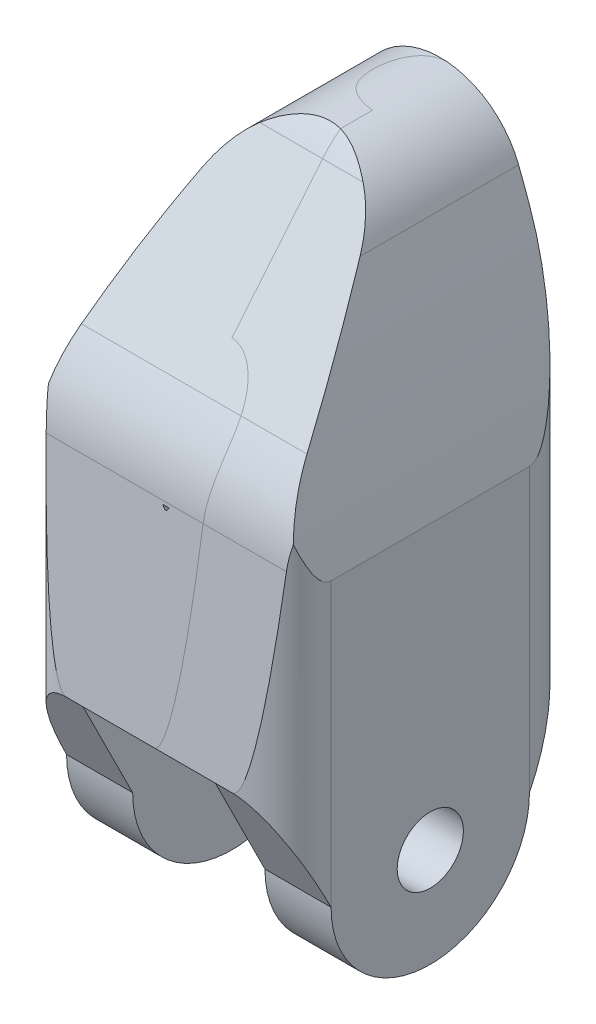
from build123d import *

# Parameters (mm, degrees)
BOSS_EXTRUDE1_DEPTH = 50.8
CUT_EXTRUDE2_START  = -20.32
SKETCH3_R           = 1.27
CUT_EXTRUDE2_DEPTH  = 50.8
CUT_EXTRUDE1_DEPTH  = 50.8
SKETCH4_W           = 10.16
SKETCH4_H           = 15.24
CUT_EXTRUDE3_DEPTH  = 50.8
SKETCH5_R           = 2.54
CUT_EXTRUDE5_DEPTH  = 50.8
CUT_EXTRUDE6_DEPTH  = 32.512
CUT_EXTRUDE7_DEPTH  = 32.512


with BuildPart() as part:
    # Sketch1 → Boss-Extrude1 (new body)
    with BuildSketch(Plane(origin=(0, 0, 0), x_dir=(1, 0, 0), z_dir=(0, 1, 0))):
        with BuildLine():
            Line((-20.32, 27.095319289), (-20.32, 11.855319289))
            ThreePointArc((-20.32, 11.855319289), (-19.204076836, 9.161242453), (-16.51, 8.045319289))
            Line((-16.51, 8.045319289), (-3.81, 8.045319289))
            ThreePointArc((-3.81, 8.045319289), (-1.115923164, 9.161242453), (0, 11.855319289))
            Line((0, 11.855319289), (0, 27.095319289))
            ThreePointArc((0, 27.095319289), (-1.115923164, 29.789396126), (-3.81, 30.905319289))
            Line((-3.81, 30.905319289), (-16.51, 30.905319289))
            ThreePointArc((-16.51, 30.905319289), (-19.204076836, 29.789396126), (-20.32, 27.095319289))
        make_face()
    extrude(amount=BOSS_EXTRUDE1_DEPTH)

    # Sketch3 → Cut-Extrude2 (cut)
    with BuildSketch(Plane(origin=(0, 50.8, 0), x_dir=(1, 0, 0), z_dir=(0, 1, 0)).offset(CUT_EXTRUDE2_START)):
        with Locations(Location((-10.16, 10.585319289, 0), (0, 0, 270))):
            Circle(SKETCH3_R)
        with Locations(Location((-10.16, 28.365319289, 0), (0, 0, 270))):
            Circle(SKETCH3_R)
    extrude(amount=-CUT_EXTRUDE2_DEPTH, mode=Mode.SUBTRACT)

    # Sketch2 → Cut-Extrude1 (cut)
    with BuildSketch(Plane.ZY.offset(20.32)):
        with BuildLine():
            Line((-27.095319289, 7.62), (-30.905319289, 15.24))
            Line((-30.905319289, 15.24), (-30.905319289, -5.08))
            Line((-30.905319289, -5.08), (-8.045319289, -5.08))
            Line((-8.045319289, -5.08), (-8.045319289, 15.24))
            Line((-8.045319289, 15.24), (-11.855319289, 7.62))
            ThreePointArc((-11.855319289, 7.62), (-19.475319289, 0), (-27.095319289, 7.62))
        make_face()
    extrude(amount=-CUT_EXTRUDE1_DEPTH, mode=Mode.SUBTRACT)

    # Sketch4 → Cut-Extrude3 (cut)
    with BuildSketch(Plane.XY.offset(-8.045319289)):
        with Locations((-10.16, 7.62)):
            Rectangle(SKETCH4_W, SKETCH4_H)
    extrude(amount=-CUT_EXTRUDE3_DEPTH, mode=Mode.SUBTRACT)

    # Sketch5 → Cut-Extrude5 (cut)
    with BuildSketch(Plane.ZY.offset(20.32)):
        with Locations((-19.475319289, 7.62)):
            Circle(SKETCH5_R)
    extrude(amount=-CUT_EXTRUDE5_DEPTH, mode=Mode.SUBTRACT)

    # Sketch6 → Cut-Extrude6 (cut)
    with BuildSketch(Plane.ZY.offset(20.32)):
        with BuildLine():
            Line((-11.855319289, 36.846817341), (-21.012334943, 47.93447962))
            ThreePointArc((-21.012334943, 47.93447962), (-23.733254983, 50.047756788), (-27.095319289, 50.8))
            Line((-27.095319289, 50.8), (-31.52544936, 50.8))
            Line((-31.52544936, 50.8), (-31.52544936, 15.08846866))
            Line((-31.52544936, 15.08846866), (-40.392656277, 51.934271372))
            Line((-40.392656277, 51.934271372), (12.273740193, 71.26134954))
            Line((12.273740193, 71.26134954), (-8.045319289, 15.24))
            Line((-8.045319289, 15.24), (-9.357524517, 30.725540243))
            ThreePointArc((-9.357524517, 30.725540243), (-10.139323425, 33.97677891), (-11.855319289, 36.846817341))
        make_face()
    extrude(amount=-CUT_EXTRUDE6_DEPTH, mode=Mode.SUBTRACT)

    # Sketch7 → Cut-Extrude7 (cut)
    with BuildSketch(Plane(origin=(0, 0, -30.905319289), x_dir=(-1, 0, 0), z_dir=(0, 0, -1))):
        with BuildLine():
            Line((0, 29.335182296), (-12.852337187, 67.804770192))
            Line((-12.852337187, 67.804770192), (37.594938904, 66.861563092))
            Line((37.594938904, 66.861563092), (20.32, 29.335182296))
            ThreePointArc((20.32, 29.335182296), (19.06442366, 37.382371637), (16.68228589, 45.170769925))
            ThreePointArc((16.68228589, 45.170769925), (10.662952429, 49.301878805), (4.643618968, 45.170769925))
            ThreePointArc((4.643618968, 45.170769925), (1.994617848, 37.348921605), (0, 29.335182296))
        make_face()
    extrude(amount=-CUT_EXTRUDE7_DEPTH, mode=Mode.SUBTRACT)


solid = part.part
